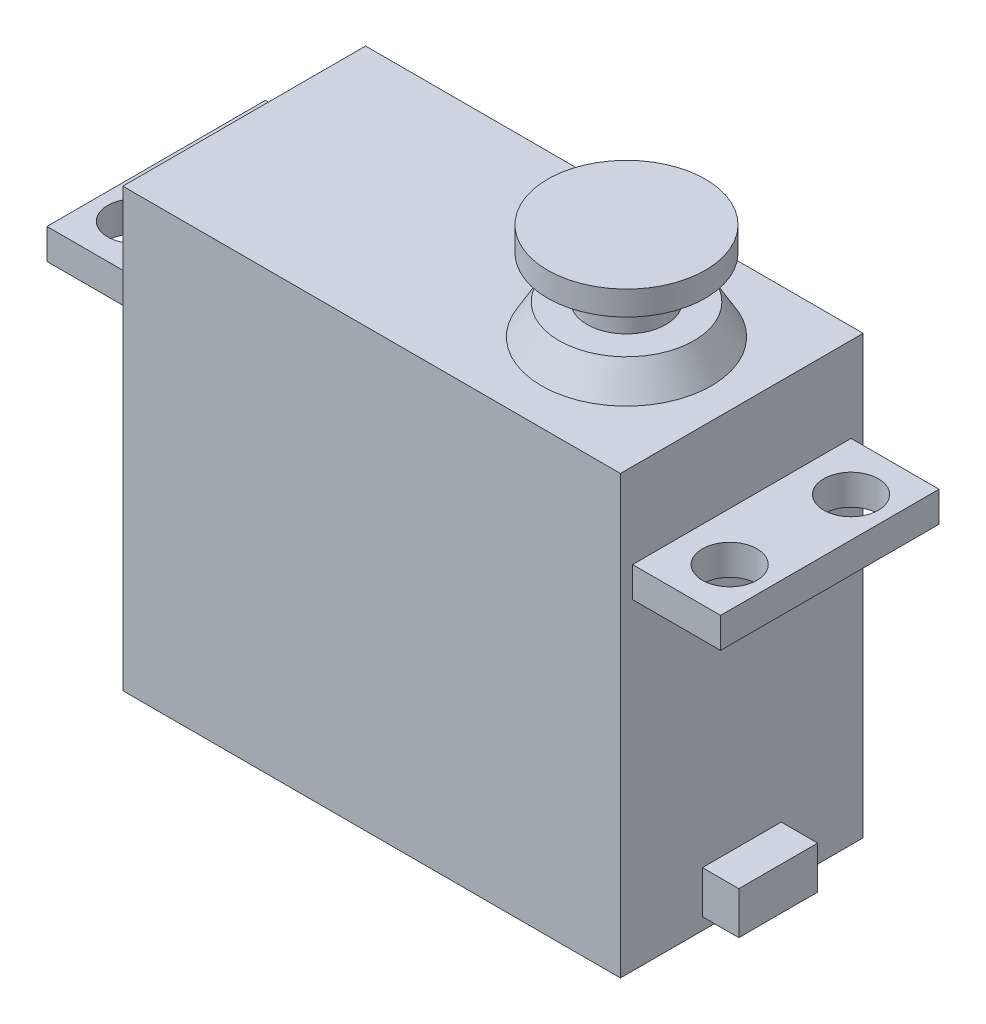
from build123d import *

# Parameters (mm, degrees)
SKETCH1_W           = 41
SKETCH1_H           = 20
BOSS_EXTRUDE1_DEPTH = 36
BOSS_EXTRUDE2_START = -26.5
SKETCH2_W           = 55.5
SKETCH2_H           = 18
BOSS_EXTRUDE2_DEPTH = 2.5
SKETCH3_W           = 6.5
SKETCH3_H           = 3.5
BOSS_EXTRUDE3_DEPTH = 3
SKETCH4_R           = 7
BOSS_EXTRUDE4_DEPTH = 2.5
BOSS_EXTRUDE4_TAPER = 30
SKETCH5_R           = 3.25
BOSS_EXTRUDE6_DEPTH = 8
SKETCH6_R           = 6.5
BOSS_EXTRUDE7_DEPTH = 2
SKETCH9_R           = 2.25
CUT_EXTRUDE1_DEPTH  = 10


with BuildPart() as part:
    # Sketch1 → Boss-Extrude1 (new body)
    with BuildSketch(Plane(origin=(0, 0, 0), x_dir=(1, 0, 0), z_dir=(0, 1, 0))):
        Rectangle(SKETCH1_W, SKETCH1_H)
    extrude(amount=BOSS_EXTRUDE1_DEPTH)

    # Sketch2 → Boss-Extrude2 (add)
    with BuildSketch(Plane.XZ.offset(BOSS_EXTRUDE2_START)):
        Rectangle(SKETCH2_W, SKETCH2_H)
    extrude(amount=-BOSS_EXTRUDE2_DEPTH)

    # Sketch3 → Boss-Extrude3 (add)
    with BuildSketch(Plane(origin=(20.5, 0, 0), x_dir=(0, 0, -1), z_dir=(1, 0, 0))):
        with Locations((0, 2.75)):
            Rectangle(SKETCH3_W, SKETCH3_H)
    extrude(amount=BOSS_EXTRUDE3_DEPTH)

    # Sketch4 → Boss-Extrude4 (add)
    with BuildSketch(Plane(origin=(0, 36, 0), x_dir=(1, 0, 0), z_dir=(0, 1, 0))):
        with Locations((11, 0)):
            Circle(SKETCH4_R)
    extrude(amount=BOSS_EXTRUDE4_DEPTH, taper=BOSS_EXTRUDE4_TAPER)

    # Sketch5 → Boss-Extrude6 (add)
    with BuildSketch(Plane(origin=(0, 36, 0), x_dir=(1, 0, 0), z_dir=(0, 1, 0))):
        with Locations(Location((11, 0, 0), (0, 0, 270))):
            Circle(SKETCH5_R)
    extrude(amount=BOSS_EXTRUDE6_DEPTH)

    # Sketch6 → Boss-Extrude7 (add)
    with BuildSketch(Plane(origin=(0, 44, 0), x_dir=(1, 0, 0), z_dir=(0, 1, 0))):
        with Locations(Location((11, 0, 0), (0, 0, 270))):
            Circle(SKETCH6_R)
    extrude(amount=-BOSS_EXTRUDE7_DEPTH)

    # Sketch9 → Cut-Extrude1 (cut)
    with BuildSketch(Plane(origin=(0, 29, 0), x_dir=(1, 0, 0), z_dir=(0, 1, 0))):
        with Locations(Location((-24.5, 5, 0), (0, 0, 270))):
            Circle(SKETCH9_R)
        with Locations(Location((24.5, 5, 0), (0, 0, 90))):
            Circle(SKETCH9_R)
        with Locations(Location((-24.5, -5, 0), (0, 0, 90))):
            Circle(SKETCH9_R)
        with Locations(Location((24.5, -5, 0), (0, 0, 270))):
            Circle(SKETCH9_R)
    extrude(amount=-CUT_EXTRUDE1_DEPTH, mode=Mode.SUBTRACT)


solid = part.part
